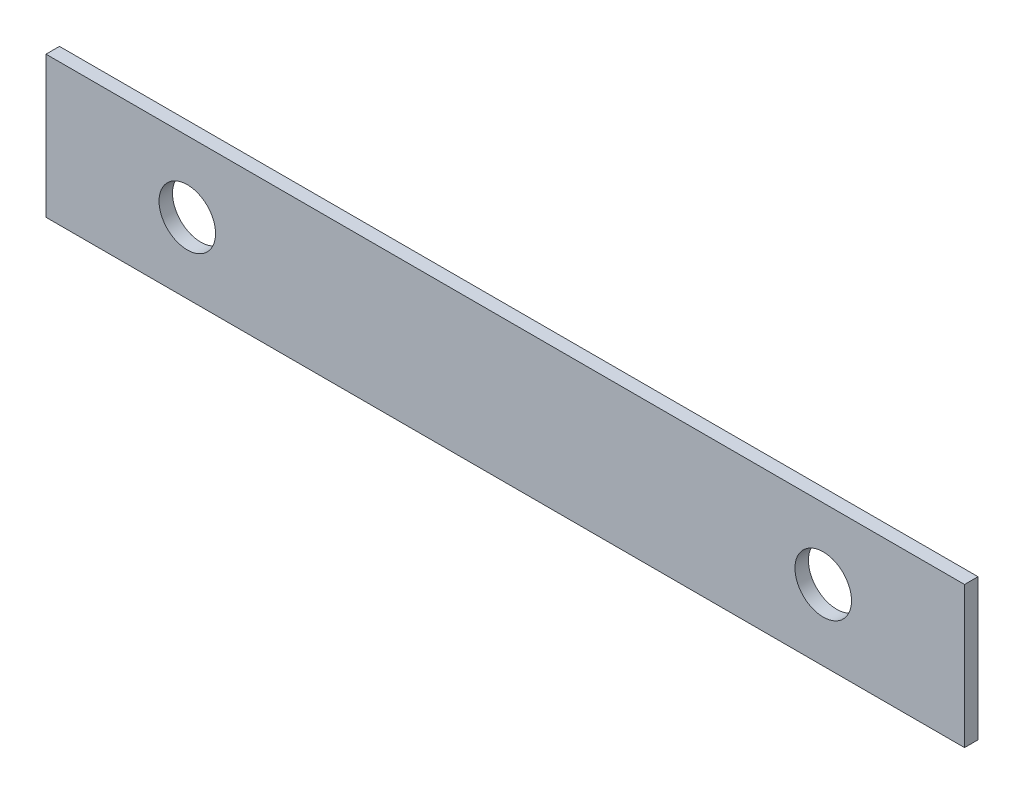
from build123d import *

# Parameters (mm, degrees)
CROQUIS1_W              = 650
CROQUIS1_H              = 100
SALIENTE_EXTRUIR1_DEPTH = 4.765
CROQUIS4_R              = 20
CORTAR_EXTRUIR3_DEPTH   = 15
CROQUIS3_R              = 20
CORTAR_EXTRUIR4_DEPTH   = 15


with BuildPart() as part:
    # Croquis1 → Saliente-Extruir1 (new, symmetric)
    with BuildSketch(Plane.XY):
        Rectangle(CROQUIS1_W, CROQUIS1_H)
    extrude(amount=SALIENTE_EXTRUIR1_DEPTH, both=True)

    # Croquis4 → Cortar-Extruir3 (cut)
    with BuildSketch(Plane(origin=(0, 0, -4.765), x_dir=(-1, 0, 0), z_dir=(0, 0, -1))):
        with Locations((225, 0)):
            Circle(CROQUIS4_R)
    extrude(amount=-CORTAR_EXTRUIR3_DEPTH, mode=Mode.SUBTRACT)

    # Croquis3 → Cortar-Extruir4 (cut)
    with BuildSketch(Plane.XY.offset(4.765)):
        with Locations((225, 0)):
            Circle(CROQUIS3_R)
    extrude(amount=-CORTAR_EXTRUIR4_DEPTH, mode=Mode.SUBTRACT)


solid = part.part
